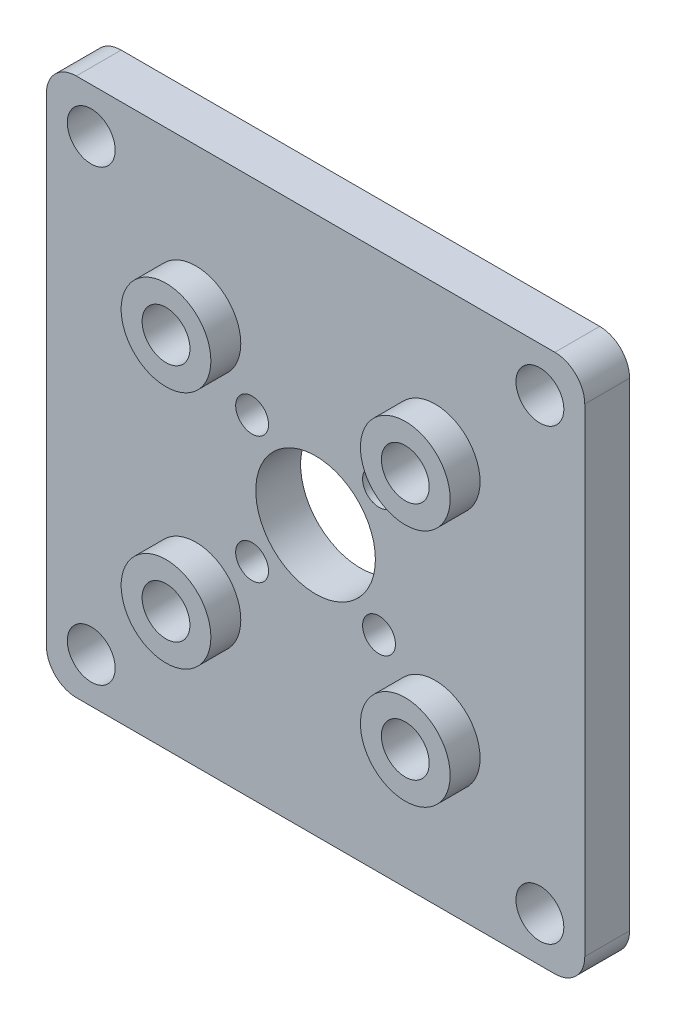
from build123d import *

# Parameters (mm, degrees)
ESQUISSE1_W             = 36
ESQUISSE1_H             = 36
ESQUISSE1_R             = 1.1
ESQUISSE1_R_2           = 4
ESQUISSE1_R_3           = 1.6
BOSS_EXTRU_1_DEPTH      = 3
ESQUISSE2_R             = 3
BOSS_EXTRU_2_DEPTH      = 2
ESQUISSE3_R             = 1.6
ENL_V_MAT_EXTRU_1_DEPTH = 26.942243542
CONG_1_R                = 2


with BuildPart() as part:
    # Esquisse1 → Boss.-Extru.1 (new body)
    with BuildSketch(Plane.XY):
        Rectangle(ESQUISSE1_W, ESQUISSE1_H)
        with Locations((-4.242640687, 4.242640687)):
            Circle(ESQUISSE1_R, mode=Mode.SUBTRACT)
        with Locations((4.242640687, 4.242640687)):
            Circle(ESQUISSE1_R, mode=Mode.SUBTRACT)
        with Locations((4.242640687, -4.242640687)):
            Circle(ESQUISSE1_R, mode=Mode.SUBTRACT)
        with Locations((-4.242640687, -4.242640687)):
            Circle(ESQUISSE1_R, mode=Mode.SUBTRACT)
        Circle(ESQUISSE1_R_2, mode=Mode.SUBTRACT)
        with Locations((-15, 15)):
            Circle(ESQUISSE1_R_3, mode=Mode.SUBTRACT)
        with Locations(Location((15, 15, 0), (0, 0, 180))):
            Circle(ESQUISSE1_R_3, mode=Mode.SUBTRACT)
        with Locations((15, -15)):
            Circle(ESQUISSE1_R_3, mode=Mode.SUBTRACT)
        with Locations(Location((-15, -15, 0), (0, 0, 180))):
            Circle(ESQUISSE1_R_3, mode=Mode.SUBTRACT)
    extrude(amount=BOSS_EXTRU_1_DEPTH)

    # Esquisse2 → Boss.-Extru.2 (add)
    with BuildSketch(Plane.XY.offset(3)):
        with Locations((-8, 8)):
            Circle(ESQUISSE2_R)
        with Locations((8, 8)):
            Circle(ESQUISSE2_R)
        with Locations((8, -8)):
            Circle(ESQUISSE2_R)
        with Locations((-8, -8)):
            Circle(ESQUISSE2_R)
    extrude(amount=BOSS_EXTRU_2_DEPTH)

    # Esquisse3 → Enlèv. mat.-Extru.1 (cut, through all)
    with BuildSketch(Plane.XY.offset(5)):
        with Locations((-8, 8)):
            Circle(ESQUISSE3_R)
        with Locations(Location((8, 8, 0), (0, 0, 180))):
            Circle(ESQUISSE3_R)
        with Locations((8, -8)):
            Circle(ESQUISSE3_R)
        with Locations(Location((-8, -8, 0), (0, 0, 180))):
            Circle(ESQUISSE3_R)
    extrude(amount=-ENL_V_MAT_EXTRU_1_DEPTH, mode=Mode.SUBTRACT)

    # Congé1
    cong_1_edges = [part.edges().sort_by_distance(p)[0] for p in [
        (-18, 18, 1.5),
        (18, 18, 1.5),
        (18, -18, 1.5),
        (-18, -18, 1.5),
    ]]
    fillet(cong_1_edges, radius=CONG_1_R)


solid = part.part
